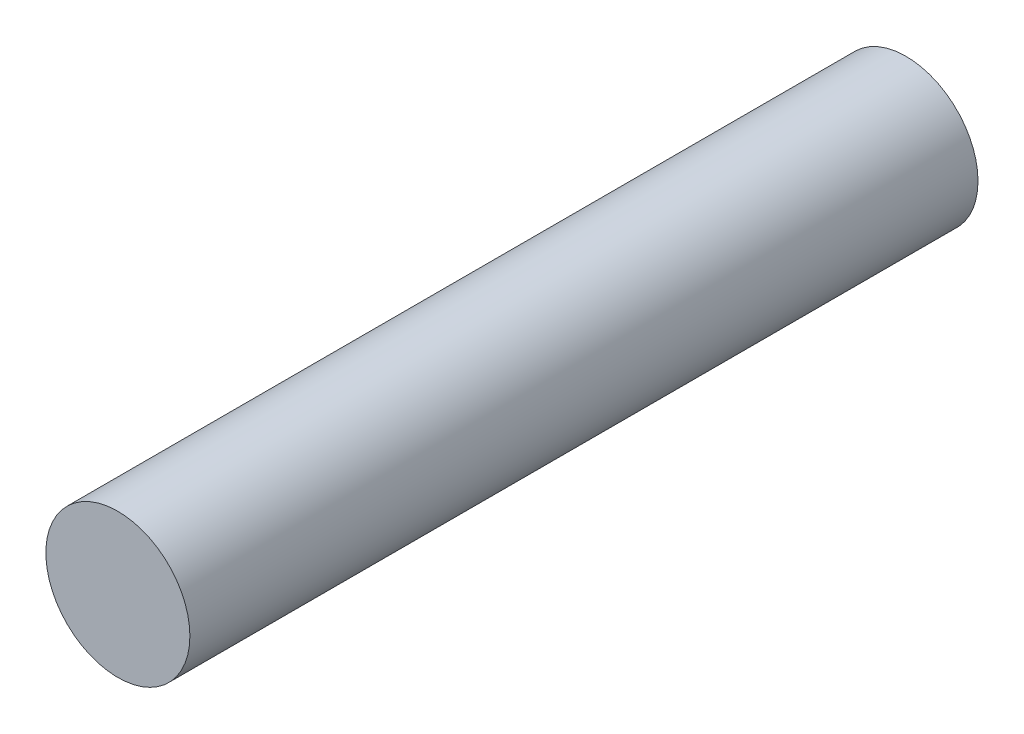
from build123d import *

# Parameters (mm, degrees)
SKETCH_1_R      = 53
EXTRUDE_1_DEPTH = 580


with BuildPart() as part:
    # 草图1 → 凸台-拉伸1 (new body)
    with BuildSketch(Plane.XY):
        Circle(SKETCH_1_R)
    extrude(amount=EXTRUDE_1_DEPTH)


solid = part.part
